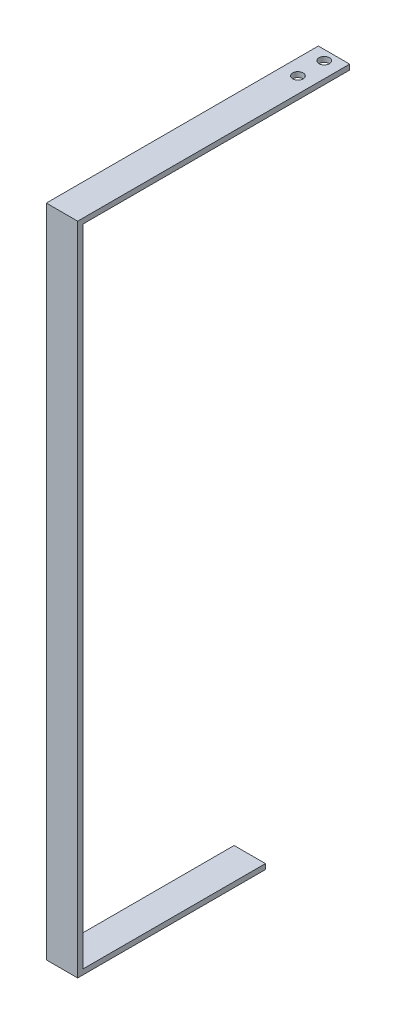
from build123d import *

# Parameters (mm, degrees)
CROQUIS1_W              = 38.1
CROQUIS1_H              = 6.31
SALIENTE_EXTRUIR1_DEPTH = 228.31
CROQUIS2_W              = 38.1
CROQUIS2_H              = 6.31
SALIENTE_EXTRUIR2_DEPTH = 790.55
CROQUIS3_W              = 38.1
CROQUIS3_H              = 6.31
SALIENTE_EXTRUIR3_DEPTH = 324.39
CROQUIS4_R              = 6.35
CORTAR_EXTRUIR1_DEPTH   = 6.31


with BuildPart() as part:
    # Croquis1 → Saliente-Extruir1 (new body)
    with BuildSketch(Plane.XY):
        Rectangle(CROQUIS1_W, CROQUIS1_H)
    extrude(amount=SALIENTE_EXTRUIR1_DEPTH)

    # Croquis2 → Saliente-Extruir2 (add)
    with BuildSketch(Plane(origin=(0, 3.155, 0), x_dir=(1, 0, 0), z_dir=(0, 1, 0))):
        with Locations((0, -225.155)):
            Rectangle(CROQUIS2_W, CROQUIS2_H)
    extrude(amount=SALIENTE_EXTRUIR2_DEPTH)

    # Croquis3 → Saliente-Extruir3 (add)
    with BuildSketch(Plane(origin=(0, 0, 222), x_dir=(-1, 0, 0), z_dir=(0, 0, -1))):
        with Locations((0, 790.55)):
            Rectangle(CROQUIS3_W, CROQUIS3_H)
    extrude(amount=SALIENTE_EXTRUIR3_DEPTH)

    # Croquis4 → Cortar-Extruir1 (cut)
    with BuildSketch(Plane(origin=(0, 793.705, 0), x_dir=(1, 0, 0), z_dir=(0, 1, 0))):
        with Locations(Location((0, 90.497795334, 0), (0, 0, 180))):
            Circle(CROQUIS4_R)
        with Locations(Location((0, 58.497795334, 0), (0, 0, 180))):
            Circle(CROQUIS4_R)
    extrude(amount=-CORTAR_EXTRUIR1_DEPTH, mode=Mode.SUBTRACT)


solid = part.part
